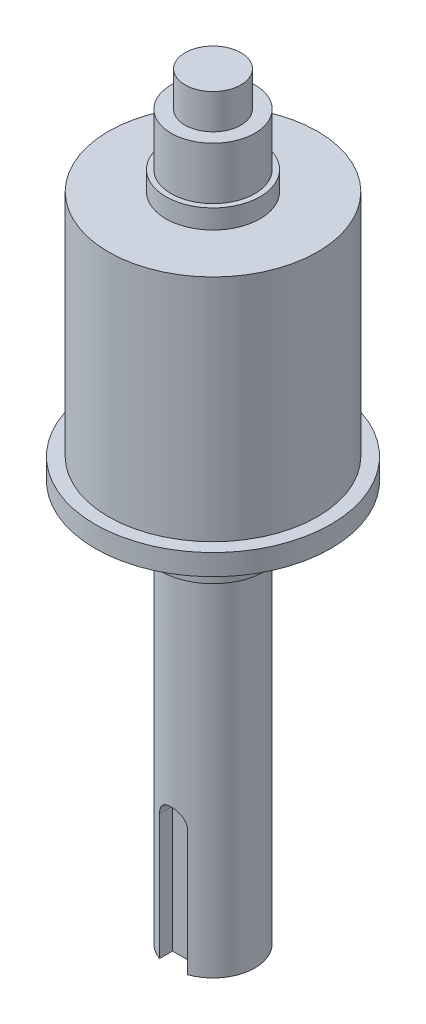
from build123d import *

# Parameters (mm, degrees)
CUT_EXTRUDE1_DEPTH = 15
CUT_EXTRUDE2_DEPTH = 112.842932653


with BuildPart() as part:
    # Sketch2 → Revolve1 (revolve)
    with BuildSketch(Plane.XY, mode=Mode.PRIVATE) as revolve1_sk:
        Polygon((0, 0), (-4, 0), (-4, -5), (-6, -5), (-6, -12.5), (-6.75, -12.5), (-6.75, -15.25), (-14.9815, -15.25), (-14.9815, -48.11), (-16.8815, -48.11), (-16.8815, -51.11), (-8.25, -51.11), (-8.25, -53.61), (-7.5, -53.61), (-7.5, -58.61), (-6, -58.61), (-6, -108.61), (0, -108.61), align=None)
    revolve(revolve1_sk.sketch.rotate(Axis((0, 40.033449689, 0), (0, -1, 0)), 270), axis=Axis((0, 40.033449689, 0), (0, -1, 0)))

    # Sketch3 → Cut-Extrude1 (cut)
    with BuildSketch(Plane.XZ.offset(108.61)):
        with BuildLine():
            Line((-2, 5.656854249), (-2, 3.8))
            Line((-2, 3.8), (2, 3.8))
            Line((2, 3.8), (2, 5.656854249))
            ThreePointArc((2, 5.656854249), (0, 6), (-2, 5.656854249))
        make_face()
    extrude(amount=-CUT_EXTRUDE1_DEPTH, mode=Mode.SUBTRACT)

    # Sketch4 → Cut-Extrude2 (cut, through all)
    with BuildSketch(Plane.XY.offset(3.8)):
        with BuildLine():
            Line((-2, -93.61), (-2, -90.61))
            ThreePointArc((-2, -90.61), (0, -88.61), (2, -90.61))
            Line((2, -90.61), (2, -93.61))
            Line((2, -93.61), (2, -108.61))
            Line((2, -108.61), (-2, -108.61))
            Line((-2, -108.61), (-2, -93.61))
        make_face()
    extrude(amount=CUT_EXTRUDE2_DEPTH, mode=Mode.SUBTRACT)


solid = part.part
